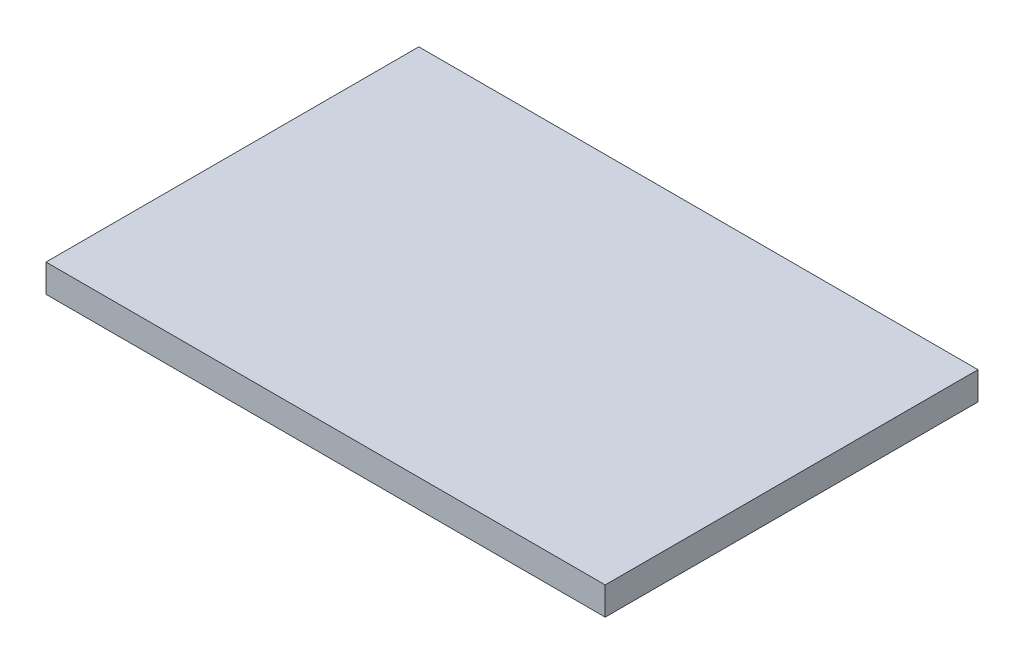
from build123d import *

# Parameters (mm, degrees)
SKETCH1_W           = 30
SKETCH1_H           = 20
BOSS_EXTRUDE1_DEPTH = 1.5


with BuildPart() as part:
    # Sketch1 → Boss-Extrude1 (new body)
    with BuildSketch(Plane(origin=(0, 0, 0), x_dir=(1, 0, 0), z_dir=(0, 1, 0))):
        Rectangle(SKETCH1_W, SKETCH1_H)
    extrude(amount=BOSS_EXTRUDE1_DEPTH)


solid = part.part
